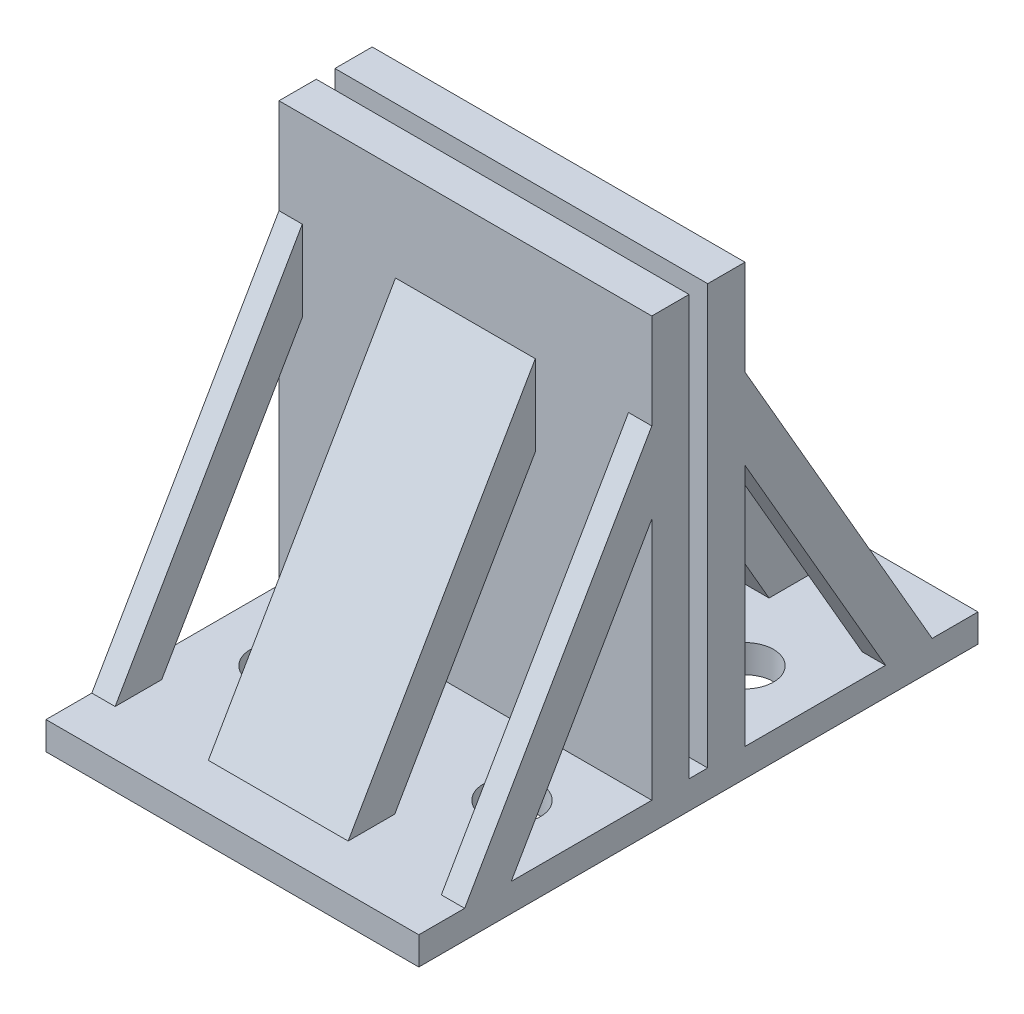
from build123d import *

# Parameters (mm, degrees)
SKETCH_1_W           = 40
SKETCH_1_H           = 60
SKETCH_1_R           = 3.05
EXTRUDE_1_DEPTH      = 3
SKETCH_2_W           = 40
SKETCH_2_H           = 4
EXTRUDE_2_DEPTH      = 45
EXTRUDE_3_DEPTH      = 20
EXTRUDE_3_DEPTH_BACK = 20
SKETCH_4_W           = 10
SKETCH_4_H           = 20.081171456
CUT_EXTRUDE_1_DEPTH  = 58.662812973


with BuildPart() as part:
    # 草图1 → 凸台-拉伸1 (new body)
    with BuildSketch(Plane(origin=(0, 0, 0), x_dir=(1, 0, 0), z_dir=(0, 1, 0))):
        Rectangle(SKETCH_1_W, SKETCH_1_H)
        with Locations((-12.5, 12.5)):
            Circle(SKETCH_1_R, mode=Mode.SUBTRACT)
        with Locations((12.5, 12.5)):
            Circle(SKETCH_1_R, mode=Mode.SUBTRACT)
        with Locations((12.5, -12.5)):
            Circle(SKETCH_1_R, mode=Mode.SUBTRACT)
        with Locations((-12.5, -12.5)):
            Circle(SKETCH_1_R, mode=Mode.SUBTRACT)
    extrude(amount=EXTRUDE_1_DEPTH)

    # 草图2 → 凸台-拉伸2 (add)
    with BuildSketch(Plane(origin=(0, 3, 0), x_dir=(1, 0, 0), z_dir=(0, 1, 0))):
        with Locations((0, 3)):
            Rectangle(SKETCH_2_W, SKETCH_2_H)
        with Locations((0, -3)):
            Rectangle(SKETCH_2_W, SKETCH_2_H)
    extrude(amount=EXTRUDE_2_DEPTH)

    # 草图3 → 凸台-拉伸3 (add, two sides: drawn at the far end of the back side and taken through both)
    with BuildSketch(Plane(origin=(0, 0, 0), x_dir=(0, 0, -1), z_dir=(1, 0, 0)).offset(-EXTRUDE_3_DEPTH_BACK)):
        Polygon((-5, 29.121355199), (-20.081171456, 3), (-25.081171456, 3), (-5, 37.781609237), align=None)
        Polygon((5, 37.781609237), (5, 29.121355199), (20.081171456, 3), (25.081171456, 3), align=None)
    extrude(amount=EXTRUDE_3_DEPTH + EXTRUDE_3_DEPTH_BACK)

    # 草图4 → 切除-拉伸1 (cut, through all)
    with BuildSketch(Plane(origin=(0, 3, 0), x_dir=(1, 0, 0), z_dir=(0, 1, 0))):
        with Locations((12.5, 15.040585728)):
            Rectangle(SKETCH_4_W, SKETCH_4_H)
        with Locations((-12.5, 15.040585728)):
            Rectangle(SKETCH_4_W, SKETCH_4_H)
        with Locations((12.5, -15.040585728)):
            Rectangle(SKETCH_4_W, SKETCH_4_H)
        with Locations((-12.5, -15.040585728)):
            Rectangle(SKETCH_4_W, SKETCH_4_H)
    extrude(amount=CUT_EXTRUDE_1_DEPTH, mode=Mode.SUBTRACT)


solid = part.part
